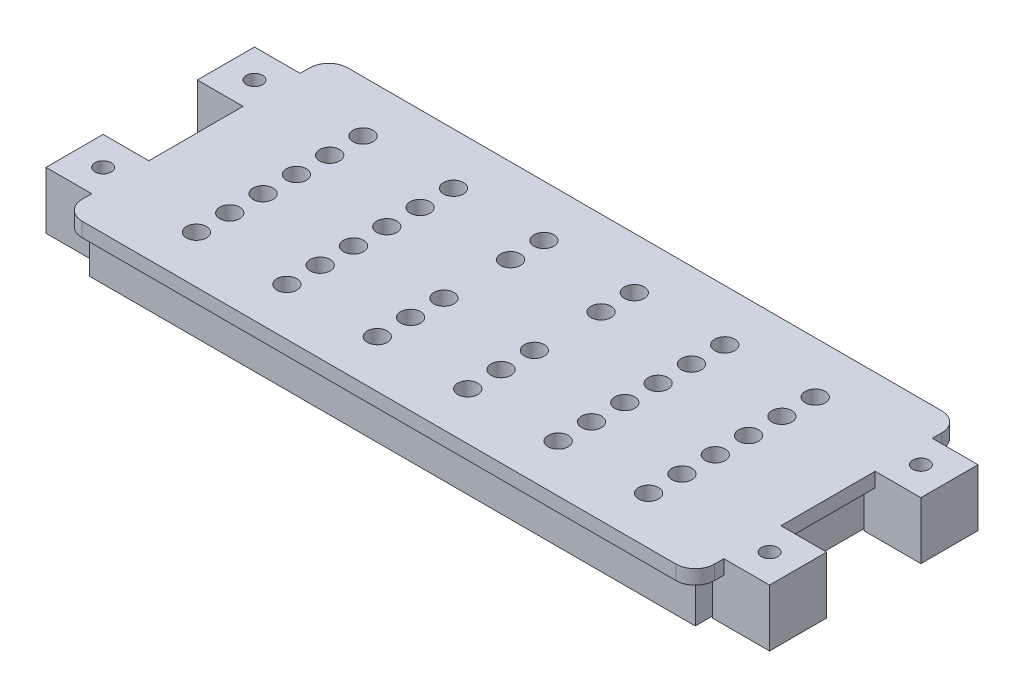
from build123d import *

# Parameters (mm, degrees)
TOP_PLATE_DEPTH               = 3
SK_TABBLOCKS_W                = 12
SK_TABBLOCKS_H                = 12
TAB_BLOCKS_DEPTH              = 12
SK_SKIRT_W                    = 127.3
SK_SKIRT_H                    = 50.3
SK_SKIRT_W_2                  = 123.2
SK_SKIRT_H_2                  = 46.2
LOCATING_SKIRT_DEPTH          = 9
M3_CLEARANCE_HOLES_DEPTH      = 163.531227769
M3_CLEARANCE_HOLES_DEPTH_BACK = 163.531227769
SK_TABHOLES_R                 = 1.7
SK_VENTS_R                    = 2.1
VENT_HOLES_DEPTH              = 3


with BuildPart() as part:
    # Sk_Plate → Top Plate (new body)
    with BuildSketch(Plane(origin=(0, 52, 0), x_dir=(1, 0, 0), z_dir=(0, 1, 0))):
        with BuildLine():
            Line((4, 0), (128.8, 0))
            ThreePointArc((128.8, 0), (131.628427125, 1.171572875), (132.8, 4))
            Line((132.8, 4), (132.8, 51.8))
            ThreePointArc((132.8, 51.8), (131.628427125, 54.628427125), (128.8, 55.8))
            Line((128.8, 55.8), (4, 55.8))
            ThreePointArc((4, 55.8), (1.171572875, 54.628427125), (0, 51.8))
            Line((0, 51.8), (0, 4))
            ThreePointArc((0, 4), (1.171572875, 1.171572875), (4, 0))
        make_face()
    extrude(amount=TOP_PLATE_DEPTH)

    # Sk_TabBlocks → Tab Blocks (add)
    with BuildSketch(Plane(origin=(0, 43, 0), x_dir=(1, 0, 0), z_dir=(0, 1, 0))):
        with Locations((-3.6, 12)):
            Rectangle(SK_TABBLOCKS_W, SK_TABBLOCKS_H)
        with Locations((136.4, 12)):
            Rectangle(SK_TABBLOCKS_W, SK_TABBLOCKS_H)
        with Locations((-3.6, 43.8)):
            Rectangle(SK_TABBLOCKS_W, SK_TABBLOCKS_H)
        with Locations((136.4, 43.8)):
            Rectangle(SK_TABBLOCKS_W, SK_TABBLOCKS_H)
    extrude(amount=TAB_BLOCKS_DEPTH)

    # Sk_Skirt → Locating Skirt (add)
    with BuildSketch(Plane(origin=(0, 43, 0), x_dir=(1, 0, 0), z_dir=(0, 1, 0))):
        with Locations((66.4, 27.9)):
            Rectangle(SK_SKIRT_W, SK_SKIRT_H)
        with Locations((66.75, 28.25)):
            Rectangle(SK_SKIRT_W_2, SK_SKIRT_H_2, mode=Mode.SUBTRACT)
    extrude(amount=LOCATING_SKIRT_DEPTH)

    # Sk_TabHoles → M3 Clearance Holes (cut, two sides: drawn at the far end of the back side and taken through both)
    with BuildSketch(Plane(origin=(0, 0, 0), x_dir=(1, 0, 0), z_dir=(0, 1, 0)).offset(-M3_CLEARANCE_HOLES_DEPTH_BACK)):
        with Locations(Location((-3.6, 12, 0), (0, 0, 90))):
            Circle(SK_TABHOLES_R)
        with Locations(Location((-3.6, 43.8, 0), (0, 0, 90))):
            Circle(SK_TABHOLES_R)
        with Locations(Location((136.4, 12, 0), (0, 0, 90))):
            Circle(SK_TABHOLES_R)
        with Locations(Location((136.4, 43.8, 0), (0, 0, 90))):
            Circle(SK_TABHOLES_R)
    extrude(amount=M3_CLEARANCE_HOLES_DEPTH + M3_CLEARANCE_HOLES_DEPTH_BACK, mode=Mode.SUBTRACT)

    # Sk_Vents → Vent Holes (cut)
    with BuildSketch(Plane(origin=(0, 52, 0), x_dir=(1, 0, 0), z_dir=(0, 1, 0))):
        with Locations(Location((18, 10, 0), (0, 0, 270))):
            Circle(SK_VENTS_R)
        with Locations(Location((18, 17, 0), (0, 0, 270))):
            Circle(SK_VENTS_R)
        with Locations(Location((18, 24, 0), (0, 0, 270))):
            Circle(SK_VENTS_R)
        with Locations(Location((18, 31, 0), (0, 0, 270))):
            Circle(SK_VENTS_R)
        with Locations(Location((18, 38, 0), (0, 0, 270))):
            Circle(SK_VENTS_R)
        with Locations(Location((18, 45, 0), (0, 0, 270))):
            Circle(SK_VENTS_R)
        with Locations(Location((37, 10, 0), (0, 0, 270))):
            Circle(SK_VENTS_R)
        with Locations(Location((37, 17, 0), (0, 0, 270))):
            Circle(SK_VENTS_R)
        with Locations(Location((37, 24, 0), (0, 0, 270))):
            Circle(SK_VENTS_R)
        with Locations(Location((37, 31, 0), (0, 0, 270))):
            Circle(SK_VENTS_R)
        with Locations(Location((37, 38, 0), (0, 0, 270))):
            Circle(SK_VENTS_R)
        with Locations(Location((37, 45, 0), (0, 0, 270))):
            Circle(SK_VENTS_R)
        with Locations(Location((56, 10, 0), (0, 0, 270))):
            Circle(SK_VENTS_R)
        with Locations(Location((56, 17, 0), (0, 0, 270))):
            Circle(SK_VENTS_R)
        with Locations(Location((56, 24, 0), (0, 0, 270))):
            Circle(SK_VENTS_R)
        with Locations(Location((56, 38, 0), (0, 0, 270))):
            Circle(SK_VENTS_R)
        with Locations(Location((56, 45, 0), (0, 0, 270))):
            Circle(SK_VENTS_R)
        with Locations(Location((75, 10, 0), (0, 0, 270))):
            Circle(SK_VENTS_R)
        with Locations(Location((75, 17, 0), (0, 0, 270))):
            Circle(SK_VENTS_R)
        with Locations(Location((75, 24, 0), (0, 0, 270))):
            Circle(SK_VENTS_R)
        with Locations(Location((75, 38, 0), (0, 0, 270))):
            Circle(SK_VENTS_R)
        with Locations(Location((75, 45, 0), (0, 0, 270))):
            Circle(SK_VENTS_R)
        with Locations(Location((94, 10, 0), (0, 0, 270))):
            Circle(SK_VENTS_R)
        with Locations(Location((94, 17, 0), (0, 0, 270))):
            Circle(SK_VENTS_R)
        with Locations(Location((94, 24, 0), (0, 0, 270))):
            Circle(SK_VENTS_R)
        with Locations(Location((94, 31, 0), (0, 0, 270))):
            Circle(SK_VENTS_R)
        with Locations(Location((94, 38, 0), (0, 0, 270))):
            Circle(SK_VENTS_R)
        with Locations(Location((94, 45, 0), (0, 0, 270))):
            Circle(SK_VENTS_R)
        with Locations(Location((113, 10, 0), (0, 0, 270))):
            Circle(SK_VENTS_R)
        with Locations(Location((113, 17, 0), (0, 0, 270))):
            Circle(SK_VENTS_R)
        with Locations(Location((113, 24, 0), (0, 0, 270))):
            Circle(SK_VENTS_R)
        with Locations(Location((113, 31, 0), (0, 0, 270))):
            Circle(SK_VENTS_R)
        with Locations(Location((113, 38, 0), (0, 0, 270))):
            Circle(SK_VENTS_R)
        with Locations(Location((113, 45, 0), (0, 0, 270))):
            Circle(SK_VENTS_R)
    extrude(amount=VENT_HOLES_DEPTH, mode=Mode.SUBTRACT)


solid = part.part
